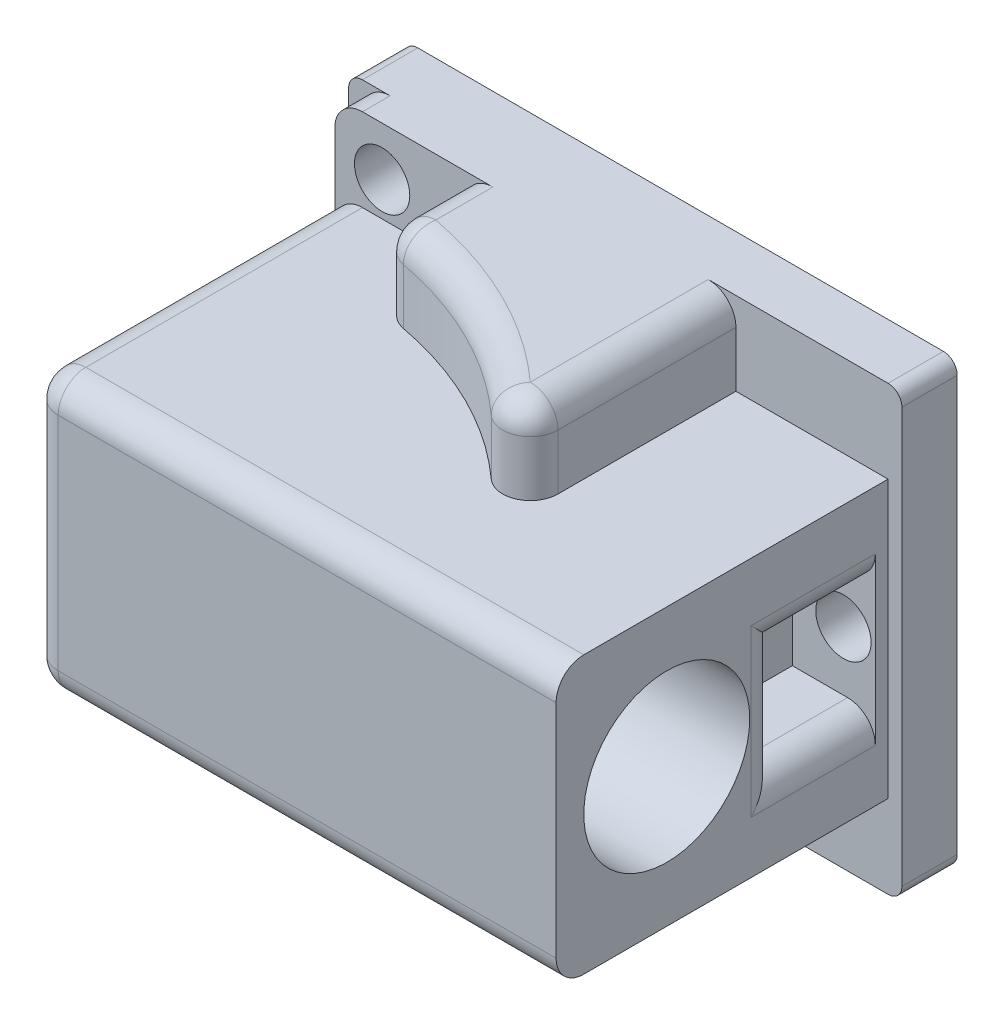
from build123d import *

# Parameters (mm, degrees)
SKETCH1_W                   = 135
SKETCH1_H                   = 110
BOSS_EXTRUDE1_DEPTH         = 100
BOSS_EXTRUDE2_DEPTH         = 29.999999629
BOSS_EXTRUDE3_START         = 30.000000371
BOSS_EXTRUDE3_DEPTH         = 30.000000371
SKETCH4_W                   = 135
SKETCH4_H                   = 100
BOSS_EXTRUDE4_DEPTH         = 30
BOSS_EXTRUDE5_DEPTH         = 55
SKETCH6_W                   = 20
SKETCH6_H                   = 160
BOSS_EXTRUDE6_DEPTH         = 5
SKETCH7_W                   = 20
SKETCH7_H                   = 160
BOSS_EXTRUDE7_DEPTH         = 5
CUT_EXTRUDE1_START          = -29.999999629
CUT_EXTRUDE1_DEPTH          = 29.999999629
CUT_EXTRUDE2_DEPTH          = 30.000000371
SKETCH10_W                  = 35
SKETCH10_H                  = 40
CUT_EXTRUDE3_DEPTH          = 30
HOLE1_D                     = 80
HOLE1_DEPTH                 = 135
HOLE2_REACH                 = 255.032
HOLE2_BORE_R                = 30
F_3_4_CLEARANCE_HOLE1_D     = 20
F_3_4_CLEARANCE_HOLE1_DEPTH = 24.602326997
F_3_4_CLEARANCE_HOLE2_D     = 20
FILLET1_R                   = 5
FILLET2_R                   = 10


with BuildPart() as part:
    # Sketch1 → Boss-Extrude1 (new body)
    with BuildSketch(Plane(origin=(0, 50.000000371, 0), x_dir=(1, 0, 0), z_dir=(0, 1, 0))):
        with Locations((-27.5, -55)):
            Rectangle(SKETCH1_W, SKETCH1_H)
    extrude(amount=-BOSS_EXTRUDE1_DEPTH)

    # Sketch2 → Boss-Extrude2 (add)
    with BuildSketch(Plane(origin=(0, 50.000000371, 0), x_dir=(-1, 0, 0), z_dir=(0, 1, 0))):
        with BuildLine():
            Line((-40, 0), (-40, 110))
            ThreePointArc((-40, 110), (20.288540009, 65.716947722), (95, 61.989412153))
            Line((95, 61.989412153), (95, 0))
            Line((95, 0), (-40, 0))
        make_face()
    extrude(amount=BOSS_EXTRUDE2_DEPTH)

    # Sketch3 → Boss-Extrude3 (add)
    with BuildSketch(Plane.XZ.offset(49.999999629).offset(BOSS_EXTRUDE3_START)):
        with BuildLine():
            Line((40, 0), (-95, 0))
            Line((-95, 0), (-95, 61.989412153))
            ThreePointArc((-95, 61.989412153), (-20.288540009, 65.716947722), (40, 110))
            Line((40, 110), (40, 0))
        make_face()
    extrude(amount=-BOSS_EXTRUDE3_DEPTH)

    # Sketch4 → Boss-Extrude4 (add)
    with BuildSketch(Plane.XY.offset(110)):
        with Locations((-27.5, 3.71e-07)):
            Rectangle(SKETCH4_W, SKETCH4_H)
    extrude(amount=BOSS_EXTRUDE4_DEPTH)

    # Sketch5 → Boss-Extrude5 (add)
    with BuildSketch(Plane(origin=(40, 0, 0), x_dir=(0, 0, -1), z_dir=(1, 0, 0))):
        Polygon((-140, 50.000000371), (-20, 50.000000371), (-20, 80), (0, 80), (0, -80), (-20, -80), (-20, -49.999999629), (-140, -49.999999629), align=None)
    extrude(amount=BOSS_EXTRUDE5_DEPTH)

    # Sketch6 → Boss-Extrude6 (add)
    with BuildSketch(Plane.ZY.offset(95)):
        with Locations((10, 0)):
            Rectangle(SKETCH6_W, SKETCH6_H)
    extrude(amount=BOSS_EXTRUDE6_DEPTH)

    # Sketch7 → Boss-Extrude7 (add)
    with BuildSketch(Plane(origin=(95, 0, 0), x_dir=(0, 0, -1), z_dir=(1, 0, 0))):
        with Locations((-10, 0)):
            Rectangle(SKETCH7_W, SKETCH7_H)
    extrude(amount=BOSS_EXTRUDE7_DEPTH)

    # Sketch8 → Cut-Extrude1 (cut)
    with BuildSketch(Plane(origin=(0, 80, 0), x_dir=(-1, 0, 0), z_dir=(0, 1, 0)).offset(CUT_EXTRUDE1_START)):
        with BuildLine():
            Line((47.874205856, 59.186990419), (47.874205856, 30))
            Line((47.874205856, 30), (95, 30))
            Line((95, 30), (95, 61.989412153))
            ThreePointArc((95, 61.989412153), (71.565380287, 58.431076847), (47.874205856, 59.186990419))
        make_face()
    extrude(amount=CUT_EXTRUDE1_DEPTH, mode=Mode.SUBTRACT)

    # Sketch9 → Cut-Extrude2 (cut)
    with BuildSketch(Plane.XZ.offset(80)):
        with BuildLine():
            Line((-47.874205856, 30), (-47.874205856, 59.186990419))
            ThreePointArc((-47.874205856, 59.186990419), (-71.565380287, 58.431076847), (-95, 61.989412153))
            Line((-95, 61.989412153), (-95, 30))
            Line((-95, 30), (-47.874205856, 30))
        make_face()
    extrude(amount=-CUT_EXTRUDE2_DEPTH, mode=Mode.SUBTRACT)

    # Sketch10 → Cut-Extrude3 (cut)
    with BuildSketch(Plane(origin=(95, 0, 0), x_dir=(0, 0, -1), z_dir=(1, 0, 0))):
        with Locations((-42.102326997, -1.102144565)):
            Rectangle(SKETCH10_W, SKETCH10_H)
    extrude(amount=-CUT_EXTRUDE3_DEPTH, mode=Mode.SUBTRACT)

    # Hole1
    with Locations(Plane(origin=(0, 0, 0), x_dir=(-1, 0, 0), z_dir=(0, 0, -1))):
        with Locations((0, 0)):
            Hole(HOLE1_D / 2, depth=HOLE1_DEPTH)

    # Hole2 bore → Hole2 (cut, up to next)
    with BuildSketch(Plane(origin=(95, 0, 0), x_dir=(0, 0, -1), z_dir=(1, 0, 0)), mode=Mode.PRIVATE) as hole2_sk1:
        with Locations((-99.999999554, 3.71e-07)):
            Circle(HOLE2_BORE_R)
    hole2_tool1 = extrude(hole2_sk1.sketch, amount=-HOLE2_REACH, mode=Mode.PRIVATE) & part.part
    add(hole2_tool1.solids().sort_by_distance((95, 0, 100))[0], mode=Mode.SUBTRACT)

    # 3/4 Clearance Hole1
    with Locations(Plane.XY.offset(24.602326997)):
        with Locations((83.46, 0.37)):
            Hole(F_3_4_CLEARANCE_HOLE1_D / 2, depth=F_3_4_CLEARANCE_HOLE1_DEPTH)

    # 3/4 Clearance Hole2 (through all)
    with Locations(Plane.XY.offset(30)):
        with Locations((-77.895356155, -62.316284924), (-77.895356155, 62.316284924)):
            Hole(F_3_4_CLEARANCE_HOLE2_D / 2)

    # Fillet1
    fillet1_edges = [part.edges().sort_by_distance(p)[0] for p in [
        (-100, -80, 10),
        (-100, 80, 10),
        (100, -80, 10),
        (100, 80, 10),
    ]]
    fillet(fillet1_edges, radius=FILLET1_R)

    # Fillet2
    fillet2_edges = [part.edges().sort_by_distance(p)[0] for p in [
        (1.227361836, 80, 75.662254106),
        (-47.874205856, 65.000000185, 59.186990419),
        (-47.874205856, 80, 44.593495209),
        (-95, -80, 25),
        (-47.874205856, -64.999999815, 59.186990419),
        (-47.874205856, -80, 44.593495209),
        (-95, 50.000000371, 85),
        (95, -21.102144565, 42.102326997),
        (95, 18.897855435, 42.102326997),
        (95, -1.102144565, 59.602326997),
        (40, 65.000000185, 110),
        (40, 80, 65),
        (-95, -49.999999629, 85),
        (40, -64.999999815, 110),
        (1.227361836, -80, 75.662254106),
        (0, 50.000000371, 140),
        (-95, 3.71e-07, 140),
        (0, -49.999999629, 140),
        (40, -80, 65),
        (-95, 80, 25),
    ]]
    fillet(fillet2_edges, radius=FILLET2_R)


solid = part.part
